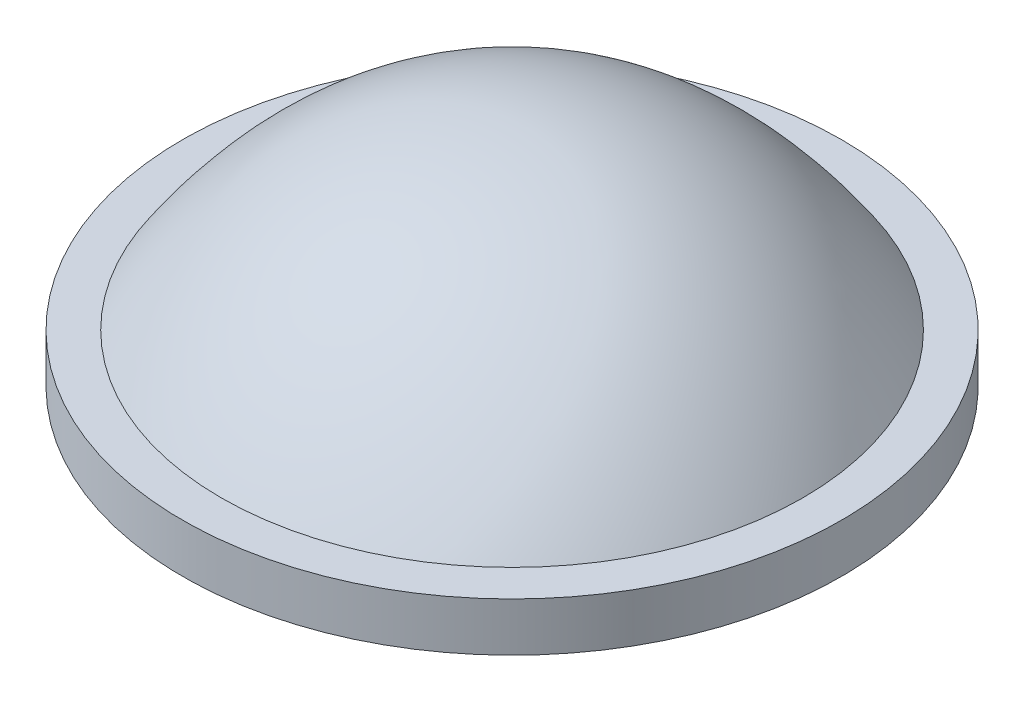
from build123d import *


with BuildPart() as part:
    # Sketch1 → Revolve1 (revolve)
    with BuildSketch(Plane(origin=(0, 0, 0), x_dir=(0, 0, -1), z_dir=(1, 0, 0)), mode=Mode.PRIVATE) as revolve1_sk:
        with BuildLine():
            Line((0, 0), (0, 7.8))
            add(Edge.make_bspline(
                [(-10.15, 1.7), (-6.081341611, 7.8), (0, 7.8)],
                knots=[0, 0, 0, 1, 1, 1], degree=2))
            Line((-10.15, 1.7), (-11.5, 1.7))
            Line((-11.5, 1.7), (-11.5, 0))
            Line((-11.5, 0), (0, 0))
        make_face()
    revolve(revolve1_sk.sketch.rotate(Axis((0, 0, 0), (0, 1, 0)), 180), axis=Axis((0, 0, 0), (0, 1, 0)))


solid = part.part
